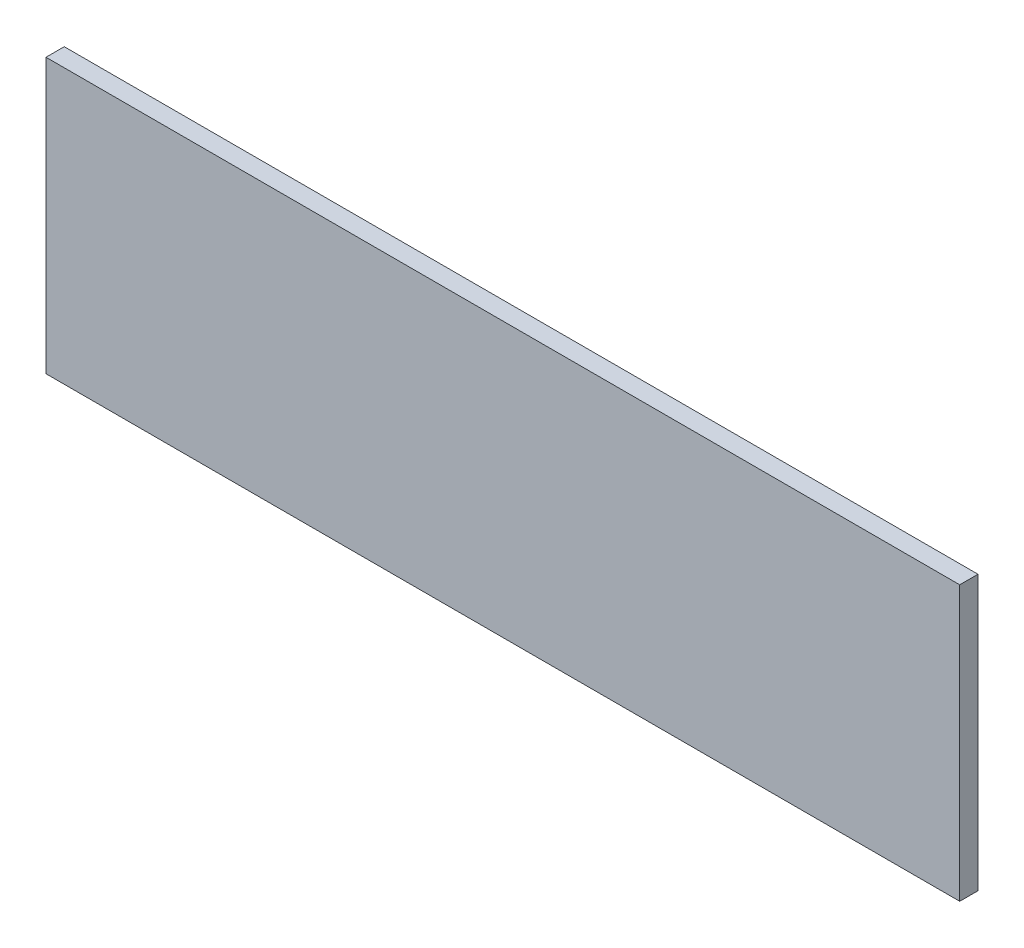
from build123d import *

# Parameters (mm, degrees)
SKETCH1_W           = 127
SKETCH1_H           = 38.1
BOSS_EXTRUDE1_DEPTH = 2.54


with BuildPart() as part:
    # Sketch1 → Boss-Extrude1 (new body)
    with BuildSketch(Plane.XY):
        with Locations((-62.146536412, 43.322113677)):
            Rectangle(SKETCH1_W, SKETCH1_H)
    extrude(amount=BOSS_EXTRUDE1_DEPTH)


solid = part.part
